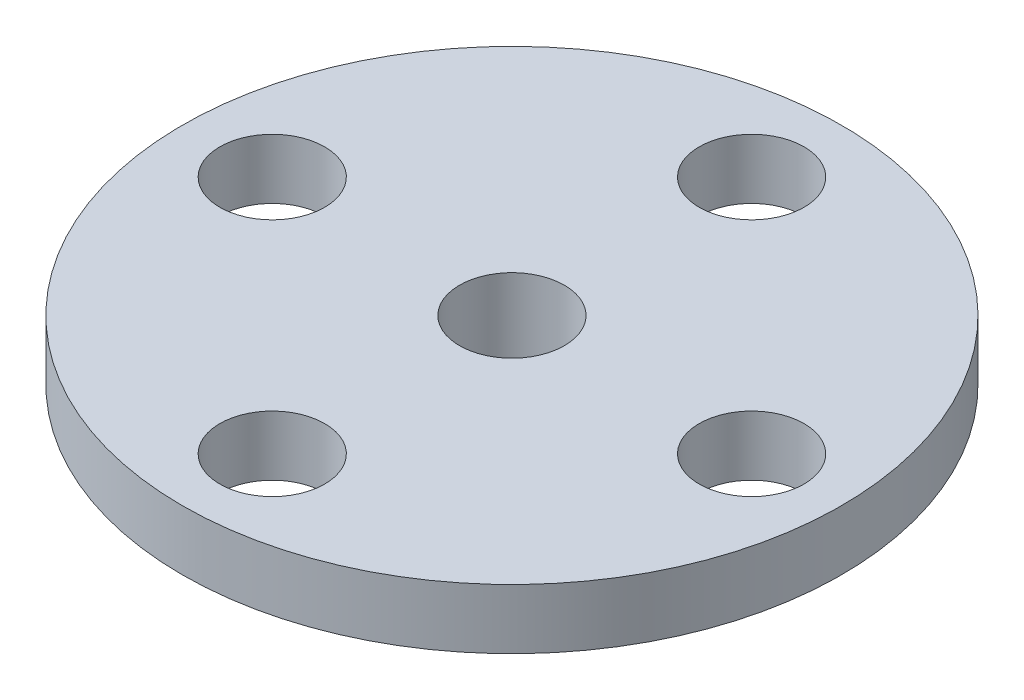
from build123d import *

# Parameters (mm, degrees)
SKETCH1_W                                        = 11
SKETCH1_H                                        = 2
SKETCH2_R                                        = 4.4
BOSS_EXTRUDE1_DEPTH                              = 4.2
F_3_5_3_5_DIAMETER_HOLE1_D                       = 3.5
CBORE_FOR_M3_HEX_HEAD_MACHINE_SCREW1_D           = 3.5
CBORE_FOR_M3_HEX_HEAD_MACHINE_SCREW1_CBORE_D     = 5.7
CBORE_FOR_M3_HEX_HEAD_MACHINE_SCREW1_CBORE_DEPTH = 3


with BuildPart() as part:
    # Sketch1 → Revolve1 (revolve)
    with BuildSketch(Plane(origin=(0, 0, 0), x_dir=(-1, 0, 0), z_dir=(0, 0, -1)), mode=Mode.PRIVATE) as revolve1_sk:
        with Locations((-5.5, 1)):
            Rectangle(SKETCH1_W, SKETCH1_H)
    revolve(revolve1_sk.sketch.rotate(Axis((0, 0, 0), (0, 1, 0)), 270), axis=Axis((0, 0, 0), (0, 1, 0)))

    # Sketch2 → Boss-Extrude1 (add)
    with BuildSketch(Plane.XZ):
        with Locations(Location((0, 0, 0), (0, 0, 270))):
            Circle(SKETCH2_R)
    extrude(amount=BOSS_EXTRUDE1_DEPTH)

    # Ø3.5 (3.5) Diameter Hole1 (through all)
    with Locations(Plane(origin=(0, 0, 0), x_dir=(-1, 0, 0), z_dir=(0, -1, 0))):
        with Locations((-8, 0), (0, -8), (8, 0), (0, 8)):
            Hole(F_3_5_3_5_DIAMETER_HOLE1_D / 2)

    # CBORE for M3 Hex Head Machine Screw1 (through all)
    with Locations(Plane(origin=(0, -4.2, 0), x_dir=(-1, 0, 0), z_dir=(0, -1, 0))):
        with Locations((0, 0)):
            CounterBoreHole(CBORE_FOR_M3_HEX_HEAD_MACHINE_SCREW1_D / 2, CBORE_FOR_M3_HEX_HEAD_MACHINE_SCREW1_CBORE_D / 2, CBORE_FOR_M3_HEX_HEAD_MACHINE_SCREW1_CBORE_DEPTH)


solid = part.part
